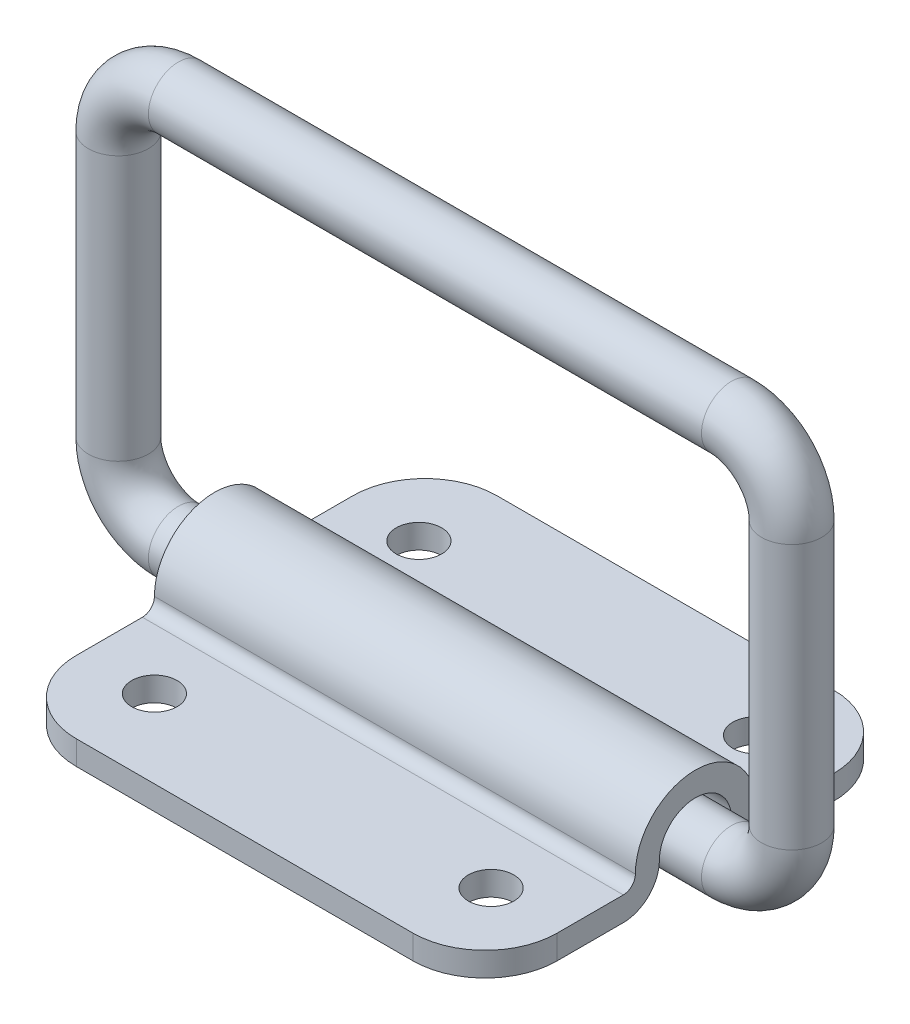
from build123d import *

# Parameters (mm, degrees)
SKETCH2_R           = 3.96875
BOSS_EXTRUDE1_DEPTH = 31.75
SKETCH4_R           = 3
CUT_EXTRUDE1_DEPTH  = 82.60969888


with BuildPart() as part:
    # Sweep1: sweep along a path in Sketch1
    with BuildLine(Plane.XY) as sweep1_path:
        Line((44.45, 42.8625), (44.45, 7.9375))
        ThreePointArc((44.45, 7.9375), (42.125160076, 2.324839924), (36.5125, 0))
        Line((36.5125, 0), (-36.5125, 0))
        ThreePointArc((-36.5125, 0), (-42.125160076, 2.324839924), (-44.45, 7.9375))
        Line((-44.45, 7.9375), (-44.45, 42.8625))
        ThreePointArc((-44.45, 42.8625), (-42.125160076, 48.475160076), (-36.5125, 50.8))
        Line((-36.5125, 50.8), (36.5125, 50.8))
        ThreePointArc((36.5125, 50.8), (42.125160076, 48.475160076), (44.45, 42.8625))
    # Sketch2 → Sweep1 (sweep)
    with BuildSketch(Plane(origin=(0, 0, 0), x_dir=(0, 0, -1), z_dir=(1, 0, 0))):
        Circle(SKETCH2_R)
    sweep(path=sweep1_path.line)


with BuildPart() as body_2:
    # Sketch3 → Boss-Extrude1 (new, symmetric)
    with BuildSketch(Plane(origin=(0, 0, 0), x_dir=(0, 0, -1), z_dir=(1, 0, 0))):
        with BuildLine():
            Line((-27.78125, -4.7625), (-27.78125, -1.5875))
            Line((-27.78125, -1.5875), (-9.525, -1.5875))
            ThreePointArc((-9.525, -1.5875), (-8.402467985, -1.122532015), (-7.9375, 0))
            ThreePointArc((-7.9375, 0), (0, 7.9375), (7.9375, 0))
            ThreePointArc((7.9375, 0), (8.402467985, -1.122532015), (9.525, -1.5875))
            Line((9.525, -1.5875), (27.78125, -1.5875))
            Line((27.78125, -1.5875), (27.78125, -4.7625))
            Line((27.78125, -4.7625), (9.525, -4.7625))
            ThreePointArc((9.525, -4.7625), (6.157403955, -3.367596045), (4.7625, 0))
            ThreePointArc((4.7625, 0), (0, 4.7625), (-4.7625, 0))
            ThreePointArc((-4.7625, 0), (-6.157403955, -3.367596045), (-9.525, -4.7625))
            Line((-9.525, -4.7625), (-27.78125, -4.7625))
        make_face()
    extrude(amount=BOSS_EXTRUDE1_DEPTH, both=True)

    # Sketch4 → Cut-Extrude1 (cut, through all)
    with BuildSketch(Plane.XZ.offset(4.7625)):
        with Locations(Location((-22.225, 17.4625, 0), (0, 0, 270))):
            Circle(SKETCH4_R)
        with Locations(Location((22.225, 17.4625, 0), (0, 0, 270))):
            Circle(SKETCH4_R)
        with Locations(Location((22.225, -17.4625, 0), (0, 0, 270))):
            Circle(SKETCH4_R)
        with Locations(Location((-22.225, -17.4625, 0), (0, 0, 270))):
            Circle(SKETCH4_R)
        with BuildLine():
            Line((-31.75, 18.25625), (-31.75, 27.78125))
            Line((-31.75, 27.78125), (-22.225, 27.78125))
            ThreePointArc((-22.225, 27.78125), (-28.960192091, 24.991442091), (-31.75, 18.25625))
        make_face()
        with BuildLine():
            Line((31.75, 27.78125), (22.225, 27.78125))
            ThreePointArc((22.225, 27.78125), (28.960192091, 24.991442091), (31.75, 18.25625))
            Line((31.75, 18.25625), (31.75, 27.78125))
        make_face()
        with BuildLine():
            Line((31.75, -18.25625), (31.75, -27.78125))
            Line((31.75, -27.78125), (22.225, -27.78125))
            ThreePointArc((22.225, -27.78125), (28.960192091, -24.991442091), (31.75, -18.25625))
        make_face()
        with BuildLine():
            Line((-31.75, -27.78125), (-22.225, -27.78125))
            ThreePointArc((-22.225, -27.78125), (-28.960192091, -24.991442091), (-31.75, -18.25625))
            Line((-31.75, -18.25625), (-31.75, -27.78125))
        make_face()
    extrude(amount=-CUT_EXTRUDE1_DEPTH, mode=Mode.SUBTRACT)


solid = Compound([part.part, body_2.part])
